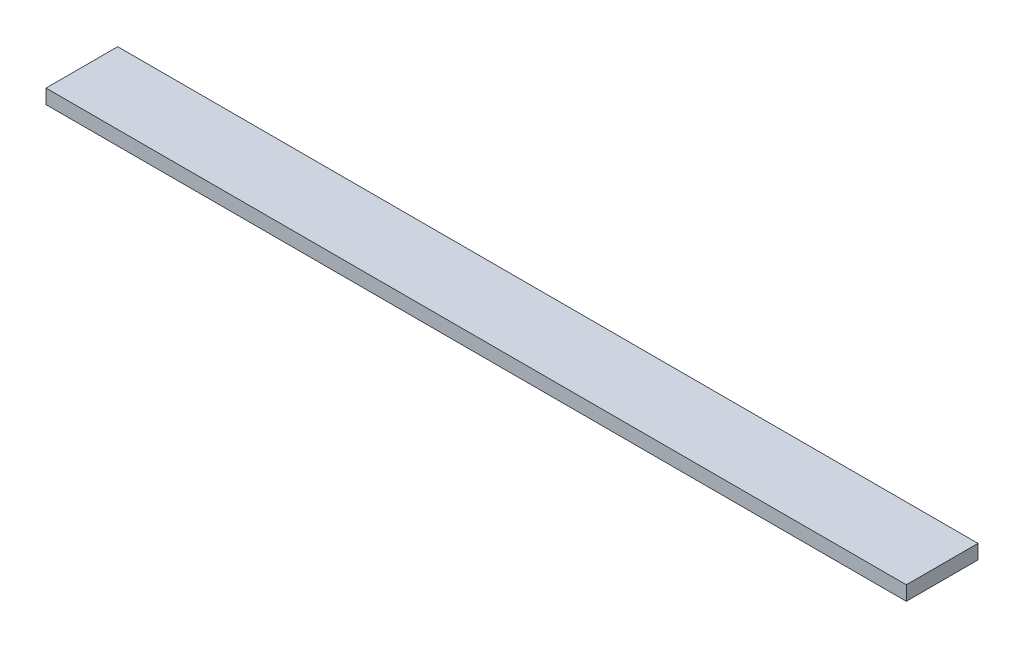
from build123d import *

# Parameters (mm, degrees)
SKETCH1_W           = 120
SKETCH1_H           = 10
BOSS_EXTRUDE1_DEPTH = 2


with BuildPart() as part:
    # Sketch1 → Boss-Extrude1 (new body)
    with BuildSketch(Plane(origin=(0, 0, 0), x_dir=(1, 0, 0), z_dir=(0, 1, 0))):
        with Locations((60, 5)):
            Rectangle(SKETCH1_W, SKETCH1_H)
    extrude(amount=BOSS_EXTRUDE1_DEPTH)


solid = part.part
